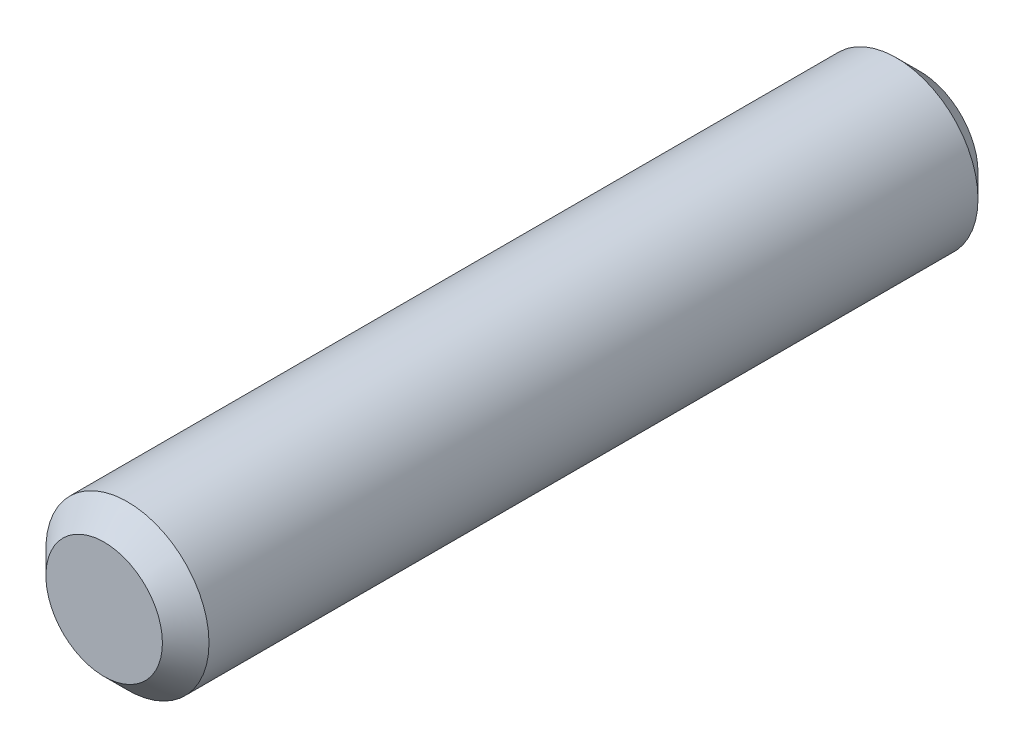
from build123d import *

# Parameters (mm, degrees)
SKETCH2_R           = 7
BOSS_EXTRUDE1_DEPTH = 35
CHAMFER1_SIZE       = 2


with BuildPart() as part:
    # Sketch2 → Boss-Extrude1 (new, symmetric)
    with BuildSketch(Plane.XY):
        Circle(SKETCH2_R)
    extrude(amount=BOSS_EXTRUDE1_DEPTH, both=True)

    # Chamfer1
    chamfer1_edges = [part.edges().sort_by_distance(p)[0] for p in [
        (-7, 0, -35),
        (-7, 0, 35),
    ]]
    chamfer(chamfer1_edges, length=CHAMFER1_SIZE)


solid = part.part
